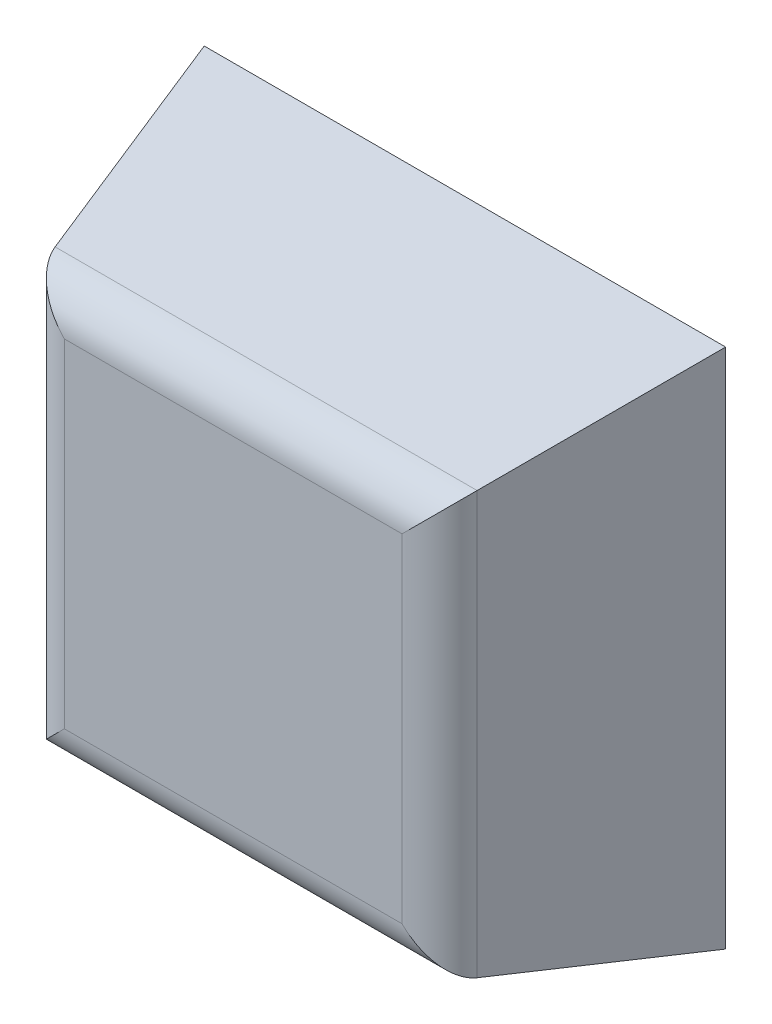
from build123d import *

# Parameters (mm, degrees)
SKETCH_3_W          = 12
SKETCH_3_H          = 12
CUT_EXTRUDE_1_DEPTH = 3
FILLET_1_R          = 1.5


with BuildPart() as part:
    # 草图1 → 放样1 section 0
    with BuildSketch(Plane.XY):
        with BuildLine():
            Line((-9, -9), (9, -9))
            Line((9, -9), (9, 9))
            Line((9, 9), (-9, 9))
            Line((-9, 9), (-9, -9))
        make_face()
    # 草图2 → 放样1 section 1
    with BuildSketch(Plane.XY.offset(8)):
        with BuildLine():
            Line((-7, -7), (7, -7))
            Line((7, -7), (7, 7))
            Line((7, 7), (-7, 7))
            Line((-7, 7), (-7, -7))
        make_face()
    loft()

    # 草图3 → 切除-拉伸1 (cut)
    with BuildSketch(Plane.XY):
        Rectangle(SKETCH_3_W, SKETCH_3_H)
    extrude(amount=CUT_EXTRUDE_1_DEPTH, mode=Mode.SUBTRACT)

    # 圆角1
    fillet_1_edges = [part.edges().sort_by_distance(p)[0] for p in [
        (0, 7, 8),
        (7, 0, 8),
        (0, -7, 8),
        (-7, 0, 8),
    ]]
    fillet(fillet_1_edges, radius=FILLET_1_R)


solid = part.part
